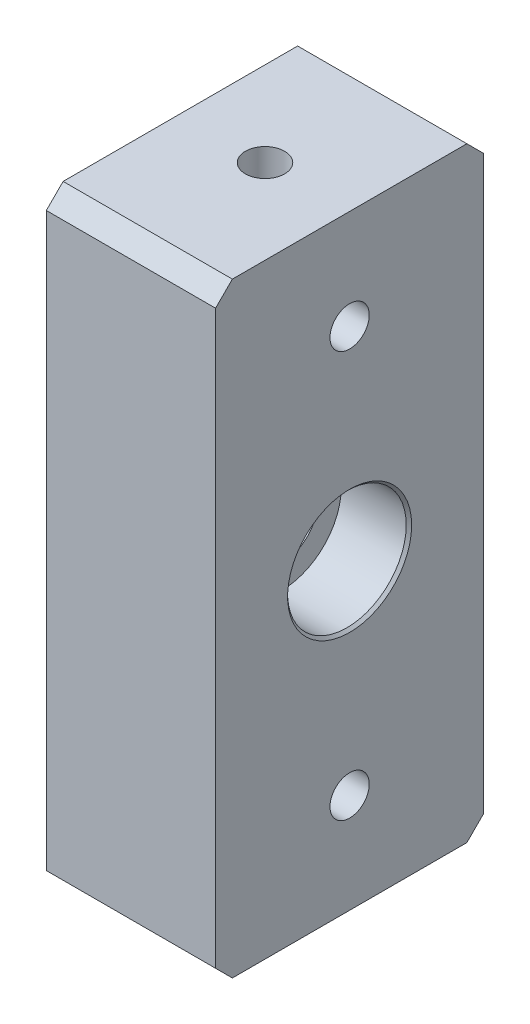
from build123d import *

# Parameters (mm, degrees)
SKETCH1_W                               = 25.146
SKETCH1_H                               = 56.769
BOSS_EXTRUDE1_DEPTH                     = 15.875
HOLE1_D                                 = 3.683
HOLE1_DEPTH                             = 12.7
HOLE1_TIP                               = 1.10648483
HOLE2_D                                 = 3.683
HOLE2_DEPTH                             = 12.7
HOLE2_TIP                               = 1.10648483
HOLE3_D                                 = 3.683
HOLE3_DEPTH                             = 23.8125
CBORE_FOR_M6_HEX_HEAD_BOLT1_D           = 6.7564
CBORE_FOR_M6_HEX_HEAD_BOLT1_CBORE_D     = 11.1252
CBORE_FOR_M6_HEX_HEAD_BOLT1_CBORE_DEPTH = 6.35
CHAMFER1_SIZE                           = 1.5748
CHAMFER2_SIZE                           = 0.254


with BuildPart() as part:
    # Sketch1 → Boss-Extrude1 (new body)
    with BuildSketch(Plane(origin=(15.875, 0, 0), x_dir=(0, 0, -1), z_dir=(1, 0, 0))):
        with Locations((-12.573, 28.7655)):
            Rectangle(SKETCH1_W, SKETCH1_H)
    extrude(amount=-BOSS_EXTRUDE1_DEPTH)

    # Hole1
    with Locations(Plane(origin=(0, 0.381, 0), x_dir=(-1, 0, 0), z_dir=(0, -1, 0))):
        with Locations((-7.9375, -12.573)):
            Hole(HOLE1_D / 2, depth=HOLE1_DEPTH)
            with Locations((0, 0, -(HOLE1_DEPTH + HOLE1_TIP / 2))):  # 118° drill point
                Cone(0, HOLE1_D / 2, HOLE1_TIP, mode=Mode.SUBTRACT)

    # Hole2
    with Locations(Plane(origin=(0, 57.15, 0), x_dir=(1, 0, 0), z_dir=(0, 1, 0))):
        with Locations((7.9375, -12.573)):
            Hole(HOLE2_D / 2, depth=HOLE2_DEPTH)
            with Locations((0, 0, -(HOLE2_DEPTH + HOLE2_TIP / 2))):  # 118° drill point
                Cone(0, HOLE2_D / 2, HOLE2_TIP, mode=Mode.SUBTRACT)

    # Hole3
    with Locations(Plane(origin=(15.875, 0, 0), x_dir=(0, 0, -1), z_dir=(1, 0, 0))):
        with Locations((-12.573, 47.8155), (-12.573, 9.7155)):
            Hole(HOLE3_D / 2, depth=HOLE3_DEPTH)

    # CBORE for M6 Hex Head Bolt1 (through all)
    with Locations(Plane(origin=(15.875, 0, 0), x_dir=(0, 0, -1), z_dir=(1, 0, 0))):
        with Locations((-12.573, 28.7655)):
            CounterBoreHole(CBORE_FOR_M6_HEX_HEAD_BOLT1_D / 2, CBORE_FOR_M6_HEX_HEAD_BOLT1_CBORE_D / 2, CBORE_FOR_M6_HEX_HEAD_BOLT1_CBORE_DEPTH)

    # Chamfer1
    chamfer1_edges = [part.edges().sort_by_distance(p)[0] for p in [
        (7.9375, 57.15, 0),
        (7.9375, 0.381, 0),
        (7.9375, 0.381, 25.146),
        (7.9375, 57.15, 25.146),
    ]]
    chamfer(chamfer1_edges, length=CHAMFER1_SIZE)

    # Chamfer2
    chamfer2_edges = [part.edges().sort_by_distance(p)[0] for p in [
        (15.875, 28.7655, 18.1356),
        (0, 28.7655, 9.1948),
    ]]
    chamfer(chamfer2_edges, length=CHAMFER2_SIZE)


solid = part.part
